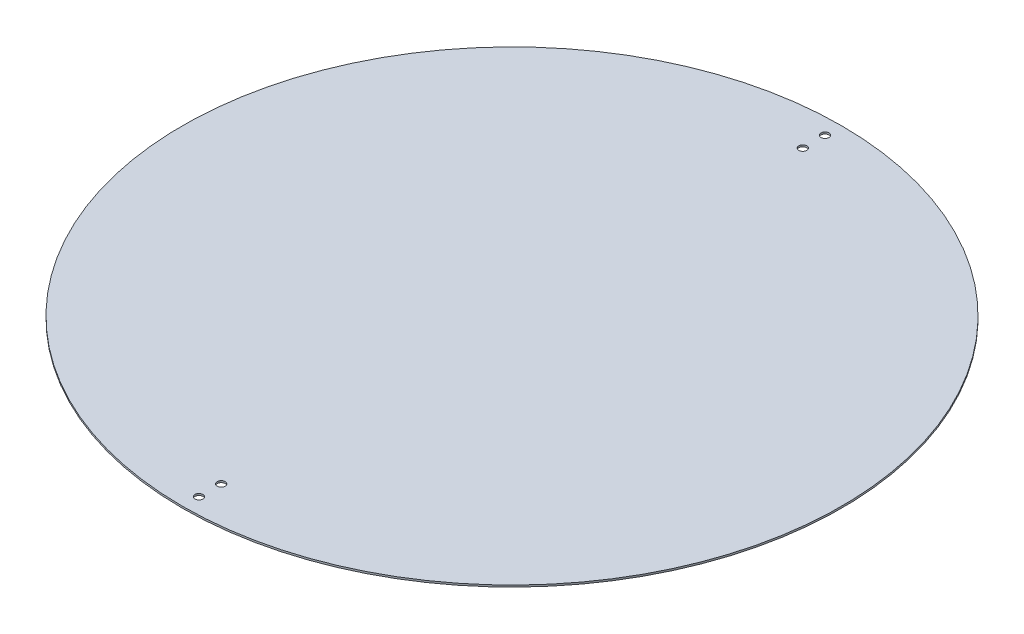
from build123d import *

# Parameters (mm, degrees)
SKETCH1_R           = 370
BOSS_EXTRUDE1_DEPTH = 1
CUT_EXTRUDE1_REACH  = 525.263
SKETCH2_R           = 4.5


with BuildPart() as part:
    # Sketch1 → Boss-Extrude1 (new, symmetric)
    with BuildSketch(Plane(origin=(0, 0, 0), x_dir=(1, 0, 0), z_dir=(0, 1, 0))):
        with Locations(Location((0, 0, 0), (0, 0, 270))):
            Circle(SKETCH1_R)
    extrude(amount=BOSS_EXTRUDE1_DEPTH, both=True)

    # Sketch2 → Cut-Extrude1 (cut, up to next)
    with BuildSketch(Plane(origin=(0, 1, 0), x_dir=(1, 0, 0), z_dir=(0, 1, 0)), mode=Mode.PRIVATE) as cut_extrude1_sk1:
        with Locations(Location((0, -351.5, 0), (0, 0, 270))):
            Circle(SKETCH2_R)
    cut_extrude1_tool1 = extrude(cut_extrude1_sk1.sketch, amount=-CUT_EXTRUDE1_REACH, mode=Mode.PRIVATE) & part.part
    # Sketch2 → Cut-Extrude1 (cut, up to next)
    with BuildSketch(Plane(origin=(0, 1, 0), x_dir=(1, 0, 0), z_dir=(0, 1, 0)), mode=Mode.PRIVATE) as cut_extrude1_sk2:
        with Locations(Location((0, -326.5, 0), (0, 0, 270))):
            Circle(SKETCH2_R)
    cut_extrude1_tool2 = extrude(cut_extrude1_sk2.sketch, amount=-CUT_EXTRUDE1_REACH, mode=Mode.PRIVATE) & part.part
    # Sketch2 → Cut-Extrude1 (cut, up to next)
    with BuildSketch(Plane(origin=(0, 1, 0), x_dir=(1, 0, 0), z_dir=(0, 1, 0)), mode=Mode.PRIVATE) as cut_extrude1_sk3:
        with Locations(Location((0, 326.5, 0), (0, 0, 270))):
            Circle(SKETCH2_R)
    cut_extrude1_tool3 = extrude(cut_extrude1_sk3.sketch, amount=-CUT_EXTRUDE1_REACH, mode=Mode.PRIVATE) & part.part
    # Sketch2 → Cut-Extrude1 (cut, up to next)
    with BuildSketch(Plane(origin=(0, 1, 0), x_dir=(1, 0, 0), z_dir=(0, 1, 0)), mode=Mode.PRIVATE) as cut_extrude1_sk4:
        with Locations(Location((0, 351.5, 0), (0, 0, 270))):
            Circle(SKETCH2_R)
    cut_extrude1_tool4 = extrude(cut_extrude1_sk4.sketch, amount=-CUT_EXTRUDE1_REACH, mode=Mode.PRIVATE) & part.part
    add(cut_extrude1_tool1.solids().sort_by_distance((0, 1, 351.5))[0], mode=Mode.SUBTRACT)
    add(cut_extrude1_tool2.solids().sort_by_distance((0, 1, 326.5))[0], mode=Mode.SUBTRACT)
    add(cut_extrude1_tool3.solids().sort_by_distance((0, 1, -326.5))[0], mode=Mode.SUBTRACT)
    add(cut_extrude1_tool4.solids().sort_by_distance((0, 1, -351.5))[0], mode=Mode.SUBTRACT)


solid = part.part
